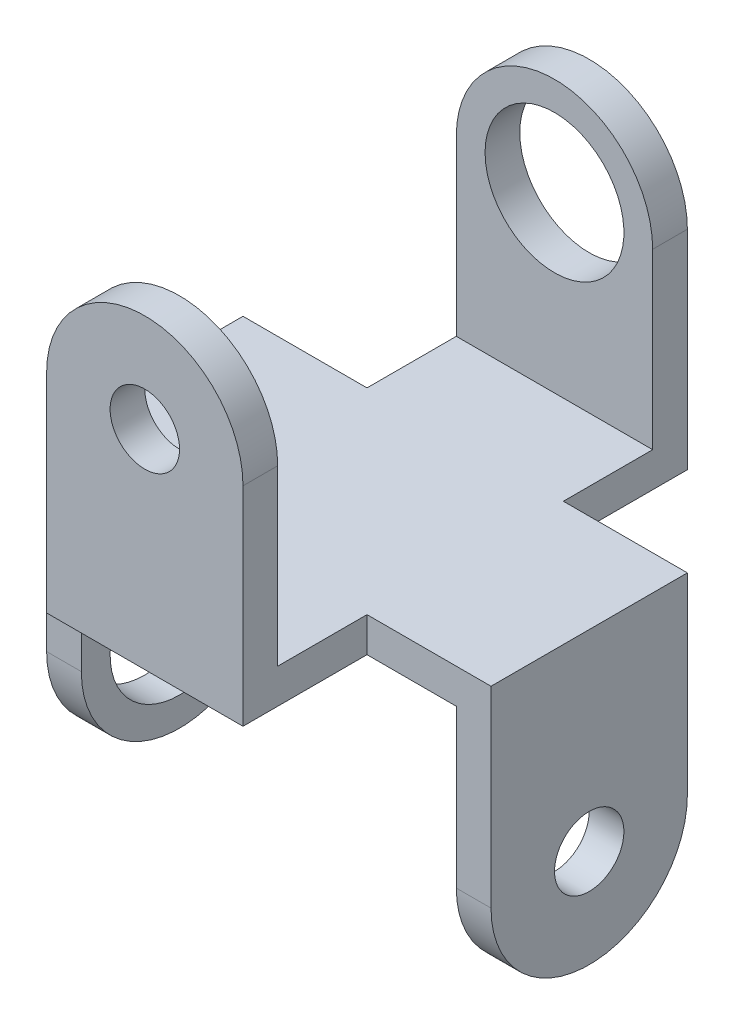
from build123d import *

# Parameters (mm, degrees)
BOSS_EXTRUDE1_DEPTH  = 5
SKETCH2_R            = 2.05
CUT_EXTRUDE1_DEPTH   = 5
SKETCH3_W            = 28.284271247
SKETCH3_H            = 5
BOSS_EXTRUDE3_DEPTH  = 5
SKETCH4_W            = 28.284271247
SKETCH4_H            = 5
BOSS_EXTRUDE4_DEPTH  = 54.01
BOSS_EXTRUDE5_DEPTH  = 5
SKETCH6_W            = 14.142135624
SKETCH6_H            = 14.14215
SKETCH6_W_2          = 12.862864377
SKETCH6_W_3          = 14.142135623
SKETCH6_W_4          = 12.862864376
BOSS_EXTRUDE7_DEPTH  = 5
SKETCH8_W            = 28.2843
SKETCH8_H            = 5
BOSS_EXTRUDE8_DEPTH  = 5
SKETCH10_W           = 5
SKETCH10_H           = 28.2843
BOSS_EXTRUDE9_DEPTH  = 22.6808
BOSS_EXTRUDE10_DEPTH = 5
SKETCH12_W           = 28.2843
SKETCH12_H           = 5
BOSS_EXTRUDE11_DEPTH = 5
BOSS_EXTRUDE12_START = -5
BOSS_EXTRUDE12_DEPTH = 5
SKETCH15_R           = 5
CUT_EXTRUDE3_DEPTH   = 5
SKETCH16_R           = 5
CUT_EXTRUDE4_DEPTH   = 14.1
SKETCH17_R           = 2.05
CUT_EXTRUDE5_DEPTH   = 8.1
SKETCH18_R           = 10
CUT_EXTRUDE6_DEPTH   = 5
SKETCH19_R           = 10
CUT_EXTRUDE7_DEPTH   = 5


with BuildPart() as part:
    # Model → Boss-Extrude1 (new body)
    with BuildSketch(Plane.XY):
        with BuildLine():
            Line((13.86155204, 4.132702322), (42.145823287, 4.132702322))
            Line((42.145823287, 4.132702322), (42.145823287, 29.132702322))
            ThreePointArc((42.145823287, 29.132702322), (28.003687664, 43.274837946), (13.86155204, 29.132702322))
            Line((13.86155204, 29.132702322), (13.86155204, 4.132702322))
        make_face()
    extrude(amount=BOSS_EXTRUDE1_DEPTH)

    # Sketch2 → Cut-Extrude1 (cut)
    with BuildSketch(Plane.XY.offset(5)):
        with Locations((28.003687664, 29.132702322)):
            Circle(SKETCH2_R)
    extrude(amount=-CUT_EXTRUDE1_DEPTH, mode=Mode.SUBTRACT)

    # Sketch3 → Boss-Extrude3 (add)
    with BuildSketch(Plane.XZ.offset(-4.132702322)):
        with Locations((28.003687664, 2.5)):
            Rectangle(SKETCH3_W, SKETCH3_H)
    extrude(amount=BOSS_EXTRUDE3_DEPTH)

    # Sketch4 → Boss-Extrude4 (add)
    with BuildSketch(Plane.XY.offset(5)):
        with Locations((28.003687664, 1.632702322)):
            Rectangle(SKETCH4_W, SKETCH4_H)
    extrude(amount=BOSS_EXTRUDE4_DEPTH)

    # Sketch5 → Boss-Extrude5 (add)
    with BuildSketch(Plane.XY.offset(59.01)):
        with BuildLine():
            Line((42.145823287, 4.132702322), (42.145823287, 29.132702322))
            ThreePointArc((42.145823287, 29.132702322), (28.003687664, 43.274837946), (13.86155204, 29.132702322))
            Line((13.86155204, 29.132702322), (13.86155204, 4.132702322))
            Line((13.86155204, 4.132702322), (13.86155204, -0.867297678))
            Line((13.86155204, -0.867297678), (42.145823287, -0.867297678))
            Line((42.145823287, -0.867297678), (42.145823287, 4.132702322))
        make_face()
    extrude(amount=BOSS_EXTRUDE5_DEPTH)

    # Sketch6 → Boss-Extrude7 (add)
    with BuildSketch(Plane.XZ.offset(0.867297678)):
        with Locations((20.932619852, 39.076075)):
            Rectangle(SKETCH6_W, SKETCH6_H)
        with Locations((48.577255476, 39.076075)):
            Rectangle(SKETCH6_W_2, SKETCH6_H)
        with Locations((35.074755476, 39.076075)):
            Rectangle(SKETCH6_W_3, SKETCH6_H)
        with Locations((7.430119852, 39.076075)):
            Rectangle(SKETCH6_W_4, SKETCH6_H)
        with Locations((7.430119852, 24.933925)):
            Rectangle(SKETCH6_W_4, SKETCH6_H)
        Polygon((28.003687664, 32.005), (13.86155204, 32.005), (13.86155204, 17.86285), (42.145823287, 17.86285), (42.145823287, 32.005), align=None)
        with Locations((48.577255476, 24.933925)):
            Rectangle(SKETCH6_W_2, SKETCH6_H)
    extrude(amount=-BOSS_EXTRUDE7_DEPTH)

    # Sketch8 → Boss-Extrude8 (add)
    with BuildSketch(Plane.ZY.offset(-0.998687664)):
        with Locations((32.005, 1.632702322)):
            Rectangle(SKETCH8_W, SKETCH8_H)
    extrude(amount=BOSS_EXTRUDE8_DEPTH)

    # Sketch10 → Boss-Extrude9 (add)
    with BuildSketch(Plane.XZ.offset(0.867297678)):
        with Locations((-1.501312336, 32.005)):
            Rectangle(SKETCH10_W, SKETCH10_H)
    extrude(amount=BOSS_EXTRUDE9_DEPTH)

    # Sketch11 → Boss-Extrude10 (add)
    with BuildSketch(Plane.ZY.offset(4.001312336)):
        with BuildLine():
            Line((46.14715, -23.548097678), (17.86285, -23.548097678))
            ThreePointArc((17.86285, -23.548097678), (32.005, -37.690247678), (46.14715, -23.548097678))
        make_face()
    extrude(amount=-BOSS_EXTRUDE10_DEPTH)

    # Sketch12 → Boss-Extrude11 (add)
    with BuildSketch(Plane(origin=(55.008687664, 0, 0), x_dir=(0, 0, -1), z_dir=(1, 0, 0))):
        with Locations((-32.005, 1.632702322)):
            Rectangle(SKETCH12_W, SKETCH12_H)
    extrude(amount=BOSS_EXTRUDE11_DEPTH)

    # Sketch14 → Boss-Extrude12 (add)
    with BuildSketch(Plane(origin=(60.008687664, 0, 0), x_dir=(0, 0, -1), z_dir=(1, 0, 0)).offset(BOSS_EXTRUDE12_START)):
        with BuildLine():
            Line((-17.86285, -0.867297678), (-46.14715, -0.867297678))
            Line((-46.14715, -0.867297678), (-46.14715, -23.548097678))
            ThreePointArc((-46.14715, -23.548097678), (-32.005, -37.690247678), (-17.86285, -23.548097678))
            Line((-17.86285, -23.548097678), (-17.86285, -0.867297678))
        make_face()
    extrude(amount=BOSS_EXTRUDE12_DEPTH)

    # Sketch15 → Cut-Extrude3 (cut)
    with BuildSketch(Plane.XY.offset(64.01)):
        with Locations((28.003687664, 29.132702322)):
            Circle(SKETCH15_R)
    extrude(amount=-CUT_EXTRUDE3_DEPTH, mode=Mode.SUBTRACT)

    # Sketch16 → Cut-Extrude4 (cut)
    with BuildSketch(Plane(origin=(60.008687664, 0, 0), x_dir=(0, 0, -1), z_dir=(1, 0, 0))):
        with Locations((-32.005, -23.548097678)):
            Circle(SKETCH16_R)
    extrude(amount=-CUT_EXTRUDE4_DEPTH, mode=Mode.SUBTRACT)

    # Sketch17 → Cut-Extrude5 (cut)
    with BuildSketch(Plane.ZY.offset(4.001312336)):
        with Locations(Location((32.005, -23.548097678, 0), (0, 0, 270))):
            Circle(SKETCH17_R)
    extrude(amount=-CUT_EXTRUDE5_DEPTH, mode=Mode.SUBTRACT)

    # Sketch18 → Cut-Extrude6 (cut)
    with BuildSketch(Plane(origin=(0, 0, 0), x_dir=(-1, 0, 0), z_dir=(0, 0, -1))):
        with Locations((-28.003687664, 29.132702322)):
            Circle(SKETCH18_R)
    extrude(amount=-CUT_EXTRUDE6_DEPTH, mode=Mode.SUBTRACT)

    # Sketch19 → Cut-Extrude7 (cut)
    with BuildSketch(Plane.ZY.offset(4.001312336)):
        with Locations(Location((32.005, -23.548097678, 0), (0, 0, 270))):
            Circle(SKETCH19_R)
    extrude(amount=-CUT_EXTRUDE7_DEPTH, mode=Mode.SUBTRACT)


solid = part.part
